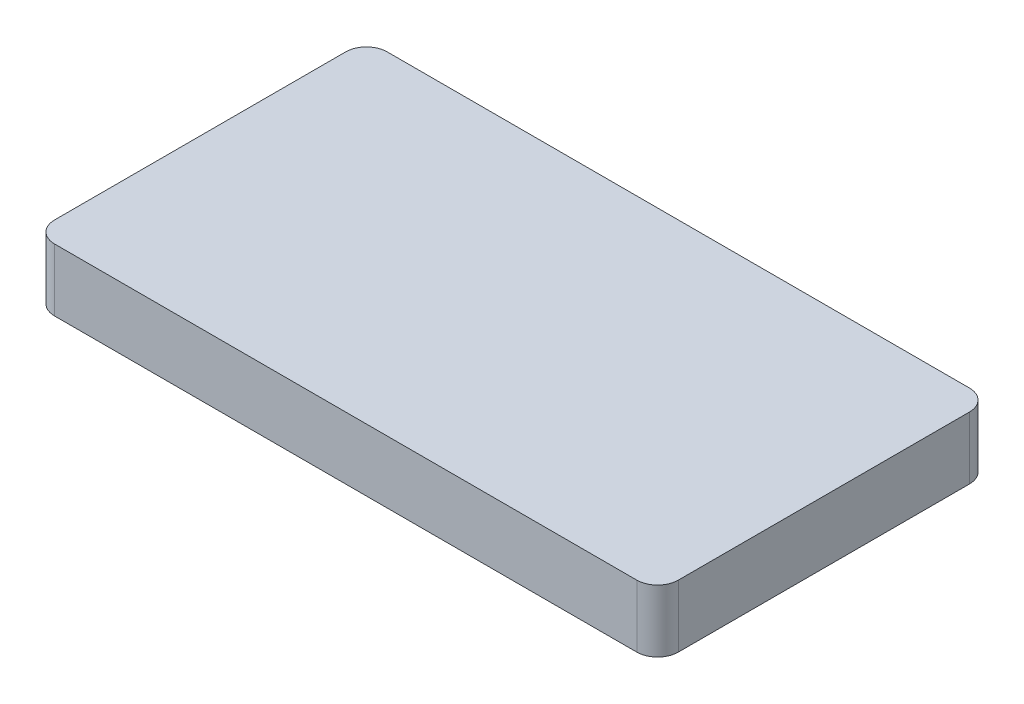
from build123d import *

# Parameters (mm, degrees)
SKETCH1_W           = 150
SKETCH1_H           = 80
BOSS_EXTRUDE1_DEPTH = 7.5
FILLET1_R           = 5


with BuildPart() as part:
    # Sketch1 → Boss-Extrude1 (new, symmetric)
    with BuildSketch(Plane(origin=(0, 0, 0), x_dir=(1, 0, 0), z_dir=(0, 1, 0))):
        Rectangle(SKETCH1_W, SKETCH1_H)
    extrude(amount=BOSS_EXTRUDE1_DEPTH, both=True)

    # Fillet1
    fillet1_edges = [part.edges().sort_by_distance(p)[0] for p in [
        (75, 0, 40),
        (-75, 0, 40),
        (-75, 0, -40),
        (75, 0, -40),
    ]]
    fillet(fillet1_edges, radius=FILLET1_R)


solid = part.part
